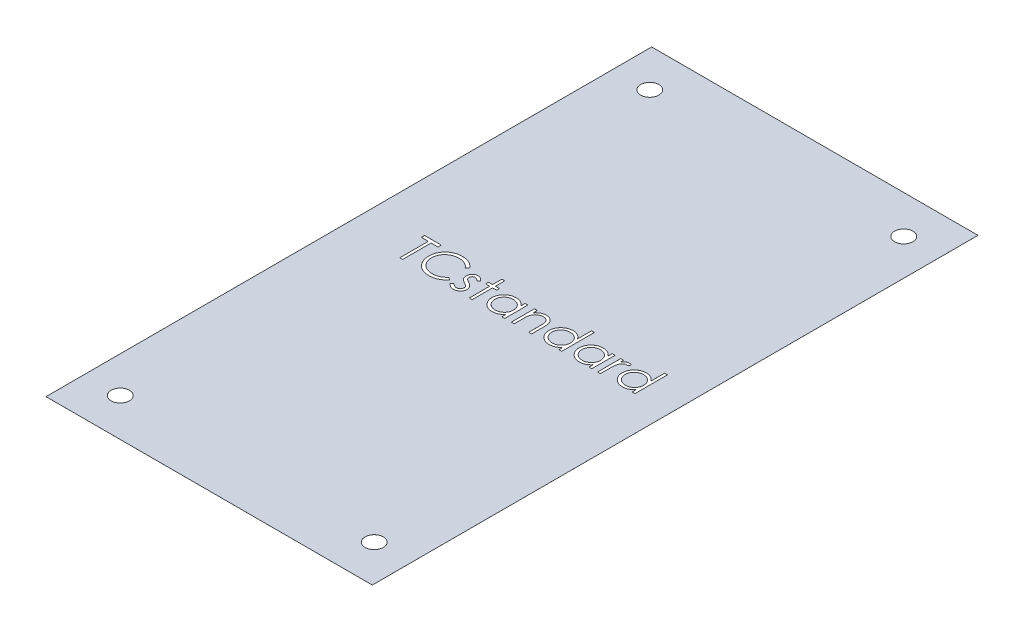
from build123d import *

# Parameters (mm, degrees)
SKETCH2_W           = 65.278
SKETCH2_H           = 121.158
BOSS_EXTRUDE1_DEPTH = 0.00254
SKETCH3_R           = 1.8288
CUT_EXTRUDE1_DEPTH  = 69.812205083
CUT_EXTRUDE2_DEPTH  = 2.54


with BuildPart() as part:
    # Sketch2 → Boss-Extrude1 (new body)
    with BuildSketch(Plane(origin=(0, 0, 0), x_dir=(1, 0, 0), z_dir=(0, 1, 0))):
        Rectangle(SKETCH2_W, SKETCH2_H)
    extrude(amount=BOSS_EXTRUDE1_DEPTH)

    # Sketch3 → Cut-Extrude1 (cut, through all)
    with BuildSketch(Plane(origin=(0, 0.00254, 0), x_dir=(1, 0, 0), z_dir=(0, 1, 0))):
        with Locations(Location((-25.4, 52.959, 0), (0, 0, 270))):
            Circle(SKETCH3_R)
        with Locations(Location((25.4, 52.959, 0), (0, 0, 270))):
            Circle(SKETCH3_R)
        with Locations(Location((25.4, -52.959, 0), (0, 0, 270))):
            Circle(SKETCH3_R)
        with Locations(Location((-25.4, -52.959, 0), (0, 0, 270))):
            Circle(SKETCH3_R)
    extrude(amount=-CUT_EXTRUDE1_DEPTH, mode=Mode.SUBTRACT)

    # Sketch5 → Cut-Extrude2 (cut)
    # profile 1 of 10: a face of its own
    with BuildSketch(Plane(origin=(0, 0.00254, 0), x_dir=(1, 0, 0), z_dir=(0, 1, 0))):
        Polygon((-22.692849894, 4.554319382), (-22.692849894, 5.205601433), (-19.355029382, 5.205601433), (-19.355029382, 4.554319382), (-20.739003741, 4.554319382), (-20.739003741, -1.144398567), (-21.308875535, -1.144398567), (-21.308875535, 4.554319382), align=None)
    # profile 2 of 10: a face of its own
    with BuildSketch(Plane(origin=(0, 0.00254, 0), x_dir=(1, 0, 0), z_dir=(0, 1, 0))):
        with BuildLine():
            Line((-12.516567843, 4.040417138), (-13.015205664, 3.658806561))
            add(Edge.make_bspline(
                [(-13.015205664, 3.658806561), (-13.050776347, 3.701199107), (-13.121438143, 3.785412654), (-13.235119839, 3.90366697), (-13.353595677, 4.014456802), (-13.476820368, 4.118309926), (-13.607011914, 4.21159463), (-13.741016506, 4.299172202), (-13.881075816, 4.377672241), (-14.074753963, 4.472855087), (-14.32811506, 4.572180254), (-14.647057125, 4.655461831), (-14.979998689, 4.708477392), (-15.207142906, 4.714219319), (-15.322677619, 4.717139895)],
                knots=[0, 0, 0, 0, 0.757959112, 1.505699292, 2.245454638, 2.979532153, 3.711538275, 4.438200793, 5.171680507, 5.909471876, 7.393775596, 8.890124382, 10.418191784, 12, 12, 12, 12], degree=3))
            add(Edge.make_bspline(
                [(-15.322677619, 4.717139895), (-15.386328748, 4.716406991), (-15.513040263, 4.714947986), (-15.701088208, 4.695700002), (-15.885624743, 4.668646807), (-16.066529832, 4.628505149), (-16.243573199, 4.577754826), (-16.417912272, 4.517111575), (-16.587022931, 4.44208208), (-16.753244592, 4.359154237), (-16.912501161, 4.265487301), (-17.063186747, 4.163318791), (-17.204751775, 4.053792002), (-17.337308228, 3.936496423), (-17.46099162, 3.811960295), (-17.574905741, 3.678856418), (-17.678656414, 3.537610332), (-17.77430016, 3.390084578), (-17.859957547, 3.236708871), (-17.931676043, 3.076915528), (-17.995185336, 2.913440941), (-18.045439676, 2.744438121), (-18.085217014, 2.571096246), (-18.112662917, 2.392950102), (-18.131692001, 2.210371855), (-18.13314375, 2.086620673), (-18.133875535, 2.024241257)],
                knots=[0, 0, 0, 0, 1.054917814, 2.100044995, 3.131103042, 4.146048494, 5.169673617, 6.183595914, 7.203665975, 8.234915748, 9.262203917, 10.264457458, 11.251630812, 12.227803204, 13.197192746, 14.159520551, 15.12972552, 16.100847026, 17.073214652, 18.039054194, 19.002613845, 19.979014051, 20.95965708, 21.949030935, 22.966165397, 24, 24, 24, 24], degree=3))
            add(Edge.make_bspline(
                [(-18.133875535, 2.024241257), (-18.131586235, 1.930385862), (-18.127091498, 1.746113244), (-18.08708952, 1.476200851), (-18.026301712, 1.217627628), (-17.935196308, 0.972009914), (-17.822857459, 0.736319036), (-17.680906635, 0.514542831), (-17.516502346, 0.303329921), (-17.327318757, 0.107672001), (-17.119753919, -0.071060043), (-16.897054137, -0.228450384), (-16.659774072, -0.359650242), (-16.410533614, -0.468826602), (-16.147414807, -0.552749523), (-15.870890809, -0.611830147), (-15.581563046, -0.650369531), (-15.38386142, -0.654059223), (-15.283244526, -0.655937028)],
                knots=[0, 0, 0, 0, 1.029171465, 2.020641659, 2.987623507, 3.938342917, 4.889210282, 5.84687017, 6.821220943, 7.821438502, 8.827599549, 9.822697543, 10.807740252, 11.797342354, 12.80366471, 13.83203677, 14.896651826, 16, 16, 16, 16], degree=3))
            add(Edge.make_bspline(
                [(-15.283244526, -0.655937028), (-15.17238679, -0.652873099), (-14.954192247, -0.646842554), (-14.634210256, -0.595753631), (-14.327893939, -0.512917123), (-14.035226817, -0.396988035), (-13.757033959, -0.24628387), (-13.492880018, -0.063589149), (-13.242542026, 0.152833969), (-13.092008414, 0.318084787), (-13.015205664, 0.402396305)],
                knots=[0, 0, 0, 0, 1.028121516, 2.023589091, 2.998037872, 3.967518031, 4.937445131, 5.927275754, 6.942489185, 8, 8, 8, 8], degree=3))
            Line((-13.015205664, 0.402396305), (-12.516567843, 0.024601834))
            add(Edge.make_bspline(
                [(-12.516567843, 0.024601834), (-12.556696414, -0.027175072), (-12.636761342, -0.130480875), (-12.766406601, -0.276116691), (-12.902981127, -0.413102584), (-13.047499343, -0.540334125), (-13.198298765, -0.660357227), (-13.358087103, -0.769761978), (-13.524763777, -0.87007544), (-13.697764045, -0.961927146), (-13.8769041, -1.043419865), (-14.061969289, -1.113185987), (-14.252161905, -1.173284001), (-14.447490641, -1.2227268), (-14.648360657, -1.261318624), (-14.854047089, -1.287117177), (-15.064993863, -1.304791793), (-15.207309012, -1.306402726), (-15.27942842, -1.30721908)],
                knots=[0, 0, 0, 0, 0.986787822, 1.968848986, 2.935600012, 3.899624008, 4.868462664, 5.837806735, 6.815139263, 7.798259679, 8.787526145, 9.778297419, 10.776456485, 11.791383307, 12.812564526, 13.85620153, 14.913611965, 16, 16, 16, 16], degree=3))
            add(Edge.make_bspline(
                [(-15.27942842, -1.30721908), (-15.347724787, -1.30674375), (-15.482772397, -1.305803845), (-15.682160132, -1.290578056), (-15.8762698, -1.269804962), (-16.064546621, -1.238526438), (-16.248018033, -1.201615993), (-16.425020808, -1.152138141), (-16.597296689, -1.096713225), (-16.764153536, -1.03157132), (-16.925733277, -0.958063389), (-17.081514763, -0.874984418), (-17.231426348, -0.783033035), (-17.376941897, -0.684236088), (-17.515911799, -0.575420126), (-17.649540338, -0.458096374), (-17.77857683, -0.332660269), (-17.858410273, -0.242209321), (-17.898549013, -0.196732301)],
                knots=[0, 0, 0, 0, 1.114604814, 2.203992996, 3.262667896, 4.300477797, 5.318619304, 6.316056647, 7.298880507, 8.271930387, 9.238335007, 10.195173496, 11.151986948, 12.108099108, 13.064862484, 14.031167946, 15.010108607, 16, 16, 16, 16], degree=3))
            add(Edge.make_bspline(
                [(-17.898549013, -0.196732301), (-17.962839395, -0.117736144), (-18.090643989, 0.039302459), (-18.254157729, 0.293821311), (-18.394125436, 0.55955649), (-18.507293178, 0.837904075), (-18.595762708, 1.128239478), (-18.657051448, 1.430709054), (-18.69687793, 1.74503032), (-18.701432311, 1.958819923), (-18.70374733, 2.067490456)],
                knots=[0, 0, 0, 0, 0.994628077, 1.977248131, 2.950237994, 3.925870899, 4.908910175, 5.911660606, 6.938484602, 8, 8, 8, 8], degree=3))
            add(Edge.make_bspline(
                [(-18.70374733, 2.067490456), (-18.700925765, 2.181709636), (-18.695374511, 2.406428742), (-18.648210711, 2.736218628), (-18.572339466, 3.052179023), (-18.46457654, 3.353720103), (-18.327951117, 3.642427897), (-18.15917426, 3.91609694), (-17.960206731, 4.176477419), (-17.732609001, 4.419618468), (-17.48302255, 4.641939865), (-17.21574413, 4.83753112), (-16.931296883, 5.000304328), (-16.632814495, 5.136368794), (-16.318061902, 5.24095232), (-15.987710646, 5.31416453), (-15.642381472, 5.359734156), (-15.406773929, 5.36549489), (-15.287060632, 5.368421946)],
                knots=[0, 0, 0, 0, 1.032925535, 2.032216505, 3.007276963, 3.968222605, 4.92396291, 5.891752235, 6.871517503, 7.883894988, 8.900124299, 9.891468569, 10.874487609, 11.85992873, 12.854644235, 13.869047385, 14.917252991, 16, 16, 16, 16], degree=3))
            add(Edge.make_bspline(
                [(-15.287060632, 5.368421946), (-15.21410009, 5.36754721), (-15.069682045, 5.365815757), (-14.85604509, 5.348931756), (-14.648051153, 5.320785642), (-14.445556943, 5.282475058), (-14.24757734, 5.234927489), (-14.055625474, 5.172987234), (-13.868574999, 5.102163813), (-13.687605609, 5.02059631), (-13.513585582, 4.929035222), (-13.346569118, 4.828495448), (-13.187882875, 4.719101629), (-13.03641025, 4.601784154), (-12.894685124, 4.474061054), (-12.758683584, 4.339445415), (-12.6330242, 4.194059763), (-12.555457689, 4.091725097), (-12.516567843, 4.040417138)],
                knots=[0, 0, 0, 0, 1.096760587, 2.17092713, 3.219439832, 4.250915756, 5.268269357, 6.278326846, 7.281116186, 8.274029601, 9.260640565, 10.235837813, 11.203064059, 12.156899882, 13.114053108, 14.069676657, 15.032185724, 16, 16, 16, 16], degree=3))
        make_face()
    # profile 3 of 10: a face of its own
    with BuildSketch(Plane(origin=(0, 0.00254, 0), x_dir=(1, 0, 0), z_dir=(0, 1, 0))):
        with BuildLine():
            Line((-9.17874733, 2.917210007), (-9.565446048, 2.519062972))
            add(Edge.make_bspline(
                [(-9.565446048, 2.519062972), (-9.598811676, 2.557731109), (-9.663136679, 2.632278724), (-9.765156651, 2.731950259), (-9.866799475, 2.815655849), (-9.966673751, 2.886326375), (-10.067290896, 2.939755541), (-10.167470162, 2.978753362), (-10.267315273, 3.002886638), (-10.334055652, 3.00599712), (-10.36682826, 3.00752451)],
                knots=[0, 0, 0, 0, 1.26578478, 2.440284043, 3.530471711, 4.527705817, 5.468200915, 6.346673037, 7.188140097, 8, 8, 8, 8], degree=3))
            add(Edge.make_bspline(
                [(-10.36682826, 3.00752451), (-10.406995439, 3.005574383), (-10.486038762, 3.00173681), (-10.599297032, 2.963431015), (-10.704436023, 2.904632304), (-10.795435115, 2.821232159), (-10.872519906, 2.7255027), (-10.928787585, 2.618466511), (-10.963197298, 2.503353631), (-10.967560169, 2.42347089), (-10.969772971, 2.382955199)],
                knots=[0, 0, 0, 0, 0.99966794, 1.967205029, 2.953328237, 3.988086729, 5.028030931, 6.008226631, 6.989793394, 8, 8, 8, 8], degree=3))
            add(Edge.make_bspline(
                [(-10.969772971, 2.382955199), (-10.967757641, 2.346284776), (-10.96373266, 2.273047304), (-10.932442256, 2.165010157), (-10.882610954, 2.059678102), (-10.836037887, 1.995156829), (-10.8120406, 1.961911529)],
                knots=[0, 0, 0, 0, 0.960159726, 1.917612774, 2.927026955, 4, 4, 4, 4], degree=3))
            add(Edge.make_bspline(
                [(-10.8120406, 1.961911529), (-10.797592547, 1.944159498), (-10.766841687, 1.906376536), (-10.709131952, 1.853936688), (-10.64377684, 1.795984318), (-10.565182096, 1.738041771), (-10.476733803, 1.677024212), (-10.376513958, 1.615334628), (-10.267703071, 1.5482706), (-10.189802529, 1.505735696), (-10.149310231, 1.483626273)],
                knots=[0, 0, 0, 0, 0.66740084, 1.420478572, 2.27185888, 3.217733974, 4.268547843, 5.408967954, 6.65319498, 8, 8, 8, 8], degree=3))
            add(Edge.make_bspline(
                [(-10.149310231, 1.483626273), (-10.099937027, 1.455967664), (-10.004564254, 1.402540338), (-9.869050233, 1.319609876), (-9.746065173, 1.237184291), (-9.634567034, 1.156145095), (-9.53670118, 1.074224892), (-9.449498349, 0.994563676), (-9.375133601, 0.914754502), (-9.33348862, 0.858995853), (-9.313583068, 0.832344222)],
                knots=[0, 0, 0, 0, 1.27191281, 2.456916733, 3.569705269, 4.599008579, 5.553216877, 6.436649441, 7.252746552, 8, 8, 8, 8], degree=3))
            add(Edge.make_bspline(
                [(-9.313583068, 0.832344222), (-9.280543968, 0.778521462), (-9.214790027, 0.671404181), (-9.145741458, 0.495022177), (-9.105717817, 0.307950265), (-9.100162074, 0.179984666), (-9.097337074, 0.114916337)],
                knots=[0, 0, 0, 0, 0.995354457, 1.980940102, 2.973342416, 4, 4, 4, 4], degree=3))
            add(Edge.make_bspline(
                [(-9.097337074, 0.114916337), (-9.098642514, 0.069070886), (-9.101215026, -0.021272584), (-9.119100376, -0.154322917), (-9.149861547, -0.281567043), (-9.191760215, -0.404385631), (-9.248337577, -0.520425422), (-9.314645724, -0.632614045), (-9.394247349, -0.738524662), (-9.485127416, -0.838018204), (-9.584632813, -0.92888806), (-9.690779664, -1.008760091), (-9.803698685, -1.075116388), (-9.922583025, -1.130026372), (-10.047702797, -1.173693068), (-10.179077565, -1.203923661), (-10.316289734, -1.222017099), (-10.4095981, -1.224528934), (-10.457142763, -1.225808823)],
                knots=[0, 0, 0, 0, 1.032770009, 2.035186124, 3.017557409, 3.978232242, 4.952395191, 5.920591857, 6.910227898, 7.931268572, 8.952309245, 9.941945286, 10.918353717, 11.897095711, 12.887975737, 13.898235213, 14.929059601, 16, 16, 16, 16], degree=3))
            add(Edge.make_bspline(
                [(-10.457142763, -1.225808823), (-10.521308924, -1.224007781), (-10.648749663, -1.220430723), (-10.837235296, -1.18685544), (-11.021422959, -1.134612368), (-11.19991881, -1.062556316), (-11.368731045, -0.971568594), (-11.523182866, -0.862598252), (-11.663810805, -0.739244971), (-11.743853959, -0.644697261), (-11.783875535, -0.597423407)],
                knots=[0, 0, 0, 0, 1.013940152, 2.01379169, 3.017749504, 4.037548394, 5.051665909, 6.043208538, 7.021604269, 8, 8, 8, 8], degree=3))
            Line((-11.783875535, -0.597423407), (-11.406081064, -0.16747549))
            add(Edge.make_bspline(
                [(-11.406081064, -0.16747549), (-11.370208258, -0.206219134), (-11.300663399, -0.281329547), (-11.189445477, -0.38134085), (-11.07627142, -0.465163157), (-10.962271346, -0.535273352), (-10.845757747, -0.589294441), (-10.727383561, -0.627246747), (-10.607389563, -0.651638353), (-10.526795116, -0.654501808), (-10.486399574, -0.655937028)],
                knots=[0, 0, 0, 0, 1.179806542, 2.287233372, 3.337373186, 4.324005949, 5.273901747, 6.200048787, 7.097828587, 8, 8, 8, 8], degree=3))
            add(Edge.make_bspline(
                [(-10.486399574, -0.655937028), (-10.431394194, -0.65344996), (-10.323922909, -0.648590647), (-10.169992089, -0.604472494), (-10.027863439, -0.535293867), (-9.904449655, -0.437168772), (-9.799398591, -0.322949376), (-9.723328903, -0.194290902), (-9.675656413, -0.05496926), (-9.67005753, 0.041609347), (-9.667208869, 0.090747667)],
                knots=[0, 0, 0, 0, 1.072336372, 2.095165389, 3.102688358, 4.141489647, 5.156069229, 6.117746104, 7.042326257, 8, 8, 8, 8], degree=3))
            add(Edge.make_bspline(
                [(-9.667208869, 0.090747667), (-9.669179717, 0.13122369), (-9.673070893, 0.211138178), (-9.703629401, 0.326799511), (-9.751912719, 0.436508063), (-9.799455438, 0.500714994), (-9.823669205, 0.533415936)],
                knots=[0, 0, 0, 0, 1.013901739, 2.00181326, 2.98231254, 4, 4, 4, 4], degree=3))
            add(Edge.make_bspline(
                [(-9.823669205, 0.533415936), (-9.838224121, 0.549808665), (-9.869929984, 0.585517948), (-9.92808735, 0.637089162), (-9.997723014, 0.692675428), (-10.079620167, 0.751334168), (-10.173943905, 0.812291638), (-10.281076525, 0.875228034), (-10.399550385, 0.943132622), (-10.483317101, 0.988162568), (-10.527104702, 1.011701193)],
                knots=[0, 0, 0, 0, 0.615000592, 1.339693406, 2.178160186, 3.116406724, 4.166410947, 5.330106347, 6.604359322, 8, 8, 8, 8], degree=3))
            add(Edge.make_bspline(
                [(-10.527104702, 1.011701193), (-10.574360749, 1.038079332), (-10.666005305, 1.089234961), (-10.795812533, 1.168911278), (-10.912919876, 1.249950477), (-11.020145204, 1.327806628), (-11.114780171, 1.406584626), (-11.196451963, 1.486371925), (-11.268376083, 1.563950757), (-11.308194959, 1.618918709), (-11.327214878, 1.64517475)],
                knots=[0, 0, 0, 0, 1.262093308, 2.447601706, 3.550203992, 4.582594899, 5.537233252, 6.418365656, 7.244515135, 8, 8, 8, 8], degree=3))
            add(Edge.make_bspline(
                [(-11.327214878, 1.64517475), (-11.360108966, 1.698053223), (-11.425908637, 1.803828648), (-11.489799056, 1.980377656), (-11.533715708, 2.16624226), (-11.537638902, 2.29448841), (-11.539644766, 2.360058565)],
                knots=[0, 0, 0, 0, 0.985009483, 1.970363186, 2.962279964, 4, 4, 4, 4], degree=3))
            add(Edge.make_bspline(
                [(-11.539644766, 2.360058565), (-11.538675583, 2.402921787), (-11.536778755, 2.486811185), (-11.521640261, 2.610071616), (-11.494078157, 2.727180409), (-11.459507083, 2.839896289), (-11.411459346, 2.946035803), (-11.354044633, 3.047014357), (-11.286576019, 3.14269238), (-11.208846048, 3.231598063), (-11.123381135, 3.312350697), (-11.031043481, 3.382742494), (-10.933909787, 3.44280688), (-10.831568797, 3.493180815), (-10.723037368, 3.531283323), (-10.609074124, 3.55751315), (-10.489909743, 3.575030447), (-10.408446272, 3.576596328), (-10.36682826, 3.577396305)],
                knots=[0, 0, 0, 0, 1.087655834, 2.128696564, 3.144119009, 4.137814668, 5.115653402, 6.093965665, 7.082169637, 8.081268856, 9.086088321, 10.061021666, 11.022561449, 11.980240094, 12.950172527, 13.934149372, 14.944599409, 16, 16, 16, 16], degree=3))
            add(Edge.make_bspline(
                [(-10.36682826, 3.577396305), (-10.317494088, 3.575392715), (-10.217900285, 3.571347951), (-10.068485464, 3.53922477), (-9.919290686, 3.486368995), (-9.769932608, 3.413368972), (-9.621505369, 3.318904782), (-9.472703357, 3.204733054), (-9.321740217, 3.071604914), (-9.22747662, 2.969824891), (-9.17874733, 2.917210007)],
                knots=[0, 0, 0, 0, 0.845714091, 1.707292901, 2.609013841, 3.555613372, 4.552488639, 5.621697636, 6.770543573, 8, 8, 8, 8], degree=3))
        make_face()
    # profile 4 of 10: a face of its own
    with BuildSketch(Plane(origin=(0, 0.00254, 0), x_dir=(1, 0, 0), z_dir=(0, 1, 0))):
        Polygon((-7.387721689, 5.368421946), (-6.817849894, 5.368421946), (-6.817849894, 3.495986049), (-6.00374733, 3.495986049), (-6.00374733, 2.926114254), (-6.817849894, 2.926114254), (-6.817849894, -1.144398567), (-7.387721689, -1.144398567), (-7.387721689, 2.926114254), (-8.201824253, 2.926114254), (-8.201824253, 3.495986049), (-7.387721689, 3.495986049), align=None)
    # profile 5 of 10: a face of its own
    with BuildSketch(Plane(origin=(0, 0.00254, 0), x_dir=(1, 0, 0), z_dir=(0, 1, 0))):
        with BuildLine():
            Line((-0.305029382, 3.495986049), (-0.305029382, -1.144398567))
            Line((-0.305029382, -1.144398567), (-0.874901177, -1.144398567))
            Line((-0.874901177, -1.144398567), (-0.874901177, -0.34174432))
            add(Edge.make_bspline(
                [(-0.874901177, -0.34174432), (-0.939160982, -0.414387583), (-1.064564802, -0.556151825), (-1.274007973, -0.741358052), (-1.49601881, -0.894444436), (-1.729519778, -1.018087854), (-1.97430002, -1.110964871), (-2.229816921, -1.176979759), (-2.496174712, -1.21942286), (-2.678061127, -1.223661072), (-2.770233709, -1.225808823)],
                knots=[0, 0, 0, 0, 1.074387032, 2.096679803, 3.090159297, 4.057316773, 5.018401886, 5.985159533, 6.978961417, 8, 8, 8, 8], degree=3))
            add(Edge.make_bspline(
                [(-2.770233709, -1.225808823), (-2.852181282, -1.223583834), (-3.013785525, -1.219196055), (-3.251509708, -1.185155876), (-3.480277075, -1.13049032), (-3.700303799, -1.054470134), (-3.91016612, -0.953630644), (-4.111660867, -0.832905808), (-4.30374418, -0.689140302), (-4.483488258, -0.524787736), (-4.649009173, -0.346271117), (-4.794263196, -0.15586991), (-4.915372355, 0.045592556), (-5.01664593, 0.255565563), (-5.094653584, 0.475665489), (-5.14903432, 0.705131208), (-5.183034845, 0.943691407), (-5.187420809, 1.106141684), (-5.189644766, 1.188514093)],
                knots=[0, 0, 0, 0, 1.033919861, 2.038935746, 3.024066025, 3.998881131, 4.97069526, 5.957263378, 6.95902576, 7.993208707, 9.027059324, 10.027763471, 11.009749337, 11.988697705, 12.965288445, 13.950418724, 14.960734635, 16, 16, 16, 16], degree=3))
            add(Edge.make_bspline(
                [(-5.189644766, 1.188514093), (-5.187371518, 1.269183956), (-5.182877429, 1.428663921), (-5.149398016, 1.663212416), (-5.093098901, 1.889124118), (-5.014090663, 2.105671715), (-4.912777401, 2.313117234), (-4.789536444, 2.511607394), (-4.644358889, 2.701689015), (-4.476986665, 2.878892527), (-4.295676439, 3.042578498), (-4.101713456, 3.184834909), (-3.899922645, 3.307692621), (-3.68717404, 3.405035356), (-3.466616579, 3.483791875), (-3.236286756, 3.53828026), (-2.997142892, 3.570388257), (-2.83478157, 3.575037843), (-2.752425215, 3.577396305)],
                knots=[0, 0, 0, 0, 1.020392517, 2.01726096, 2.990465484, 3.961182959, 4.928053699, 5.906110375, 6.912531644, 7.948652711, 8.985773172, 9.998621852, 10.987621588, 11.969261332, 12.953316658, 13.946091881, 14.958173133, 16, 16, 16, 16], degree=3))
            add(Edge.make_bspline(
                [(-2.752425215, 3.577396305), (-2.657719756, 3.574787813), (-2.472006822, 3.569672683), (-2.200357434, 3.527104592), (-1.943373881, 3.455189087), (-1.699072414, 3.357367341), (-1.468330312, 3.227376075), (-1.25333204, 3.063401003), (-1.05182752, 2.866476278), (-0.935023277, 2.715218472), (-0.874901177, 2.63736225)],
                knots=[0, 0, 0, 0, 1.038897134, 2.037228247, 3.008116434, 3.962042015, 4.918381754, 5.904844433, 6.921570401, 8, 8, 8, 8], degree=3))
            Line((-0.874901177, 2.63736225), (-0.874901177, 3.495986049))
            Line((-0.874901177, 3.495986049), (-0.305029382, 3.495986049))
        make_face()
        with BuildLine():
            add(Edge.make_bspline(
                [(-2.744793003, 3.00752451), (-2.828094731, 3.004560624), (-2.992519091, 2.998710386), (-3.233898923, 2.953038473), (-3.464881831, 2.877047852), (-3.684312566, 2.773122117), (-3.888724902, 2.642441409), (-4.071411991, 2.484378328), (-4.233868034, 2.303245459), (-4.370498742, 2.099860202), (-4.481878644, 1.881822808), (-4.560195973, 1.653904185), (-4.611847322, 1.420215154), (-4.617124209, 1.261714281), (-4.619772971, 1.182153917)],
                knots=[0, 0, 0, 0, 1.031046209, 2.035121221, 3.029706178, 4.034933723, 5.034054252, 6.02443088, 7.017295772, 8.038157696, 9.050218397, 10.03989886, 11.016116709, 12, 12, 12, 12], degree=3))
            add(Edge.make_bspline(
                [(-4.619772971, 1.182153917), (-4.616389522, 1.103069008), (-4.609635886, 0.945209177), (-4.561102483, 0.711201559), (-4.47967757, 0.483229226), (-4.36856697, 0.263227137), (-4.229435522, 0.058967413), (-4.06816611, -0.125618238), (-3.883199171, -0.284349349), (-3.678316408, -0.417223232), (-3.45949909, -0.524560949), (-3.2293861, -0.59924718), (-2.992303157, -0.647466868), (-2.831099637, -0.653099276), (-2.749881144, -0.655937028)],
                knots=[0, 0, 0, 0, 0.979072187, 1.954306742, 2.945804271, 3.96968567, 4.997920485, 5.998718438, 6.996577872, 8.005894225, 9.015743152, 10.005417472, 10.995077863, 12, 12, 12, 12], degree=3))
            add(Edge.make_bspline(
                [(-2.749881144, -0.655937028), (-2.667428204, -0.65292538), (-2.503437482, -0.646935509), (-2.261341541, -0.60106807), (-2.02640068, -0.525287536), (-1.80181528, -0.420241978), (-1.592598871, -0.290053632), (-1.40482415, -0.137640767), (-1.246045179, 0.039620724), (-1.111438587, 0.234432289), (-1.005891759, 0.447995483), (-0.929009481, 0.675387515), (-0.883554537, 0.916616301), (-0.877825513, 1.081469425), (-0.874901177, 1.165617459)],
                knots=[0, 0, 0, 0, 1.01762866, 2.023962475, 3.030623092, 4.058876274, 5.077231937, 6.066672613, 7.034107872, 8.005628644, 8.981990164, 9.965428785, 10.961468474, 12, 12, 12, 12], degree=3))
            add(Edge.make_bspline(
                [(-0.874901177, 1.165617459), (-0.876642267, 1.22973038), (-0.880069285, 1.355924898), (-0.906250461, 1.541213394), (-0.947897256, 1.718530297), (-1.006582451, 1.888062032), (-1.083673781, 2.048871275), (-1.17665187, 2.202112668), (-1.287151758, 2.346989209), (-1.413394649, 2.481505923), (-1.551580088, 2.604199648), (-1.697801612, 2.713717627), (-1.853791624, 2.803685829), (-2.01692682, 2.878146422), (-2.187490241, 2.937399451), (-2.366869794, 2.976928553), (-2.553158813, 3.004070849), (-2.680242371, 3.006361169), (-2.744793003, 3.00752451)],
                knots=[0, 0, 0, 0, 1.050140795, 2.067009409, 3.05949893, 4.030605086, 5.00011959, 5.97591094, 6.962425594, 7.979863591, 8.993523472, 9.986985069, 10.967611495, 11.937549037, 12.921786183, 13.919465291, 14.943216303, 16, 16, 16, 16], degree=3))
        make_face(mode=Mode.SUBTRACT)
    # profile 6 of 10: a face of its own
    with BuildSketch(Plane(origin=(0, 0.00254, 0), x_dir=(1, 0, 0), z_dir=(0, 1, 0))):
        with BuildLine():
            Line((0.997534721, 3.495986049), (1.567406516, 3.495986049))
            Line((1.567406516, 3.495986049), (1.567406516, 2.65898685))
            add(Edge.make_bspline(
                [(1.567406516, 2.65898685), (1.628253368, 2.734901504), (1.746328808, 2.882216539), (1.942968955, 3.075838153), (2.150784317, 3.235395919), (2.368502238, 3.36258423), (2.596418271, 3.458463109), (2.833143132, 3.527707013), (3.080094099, 3.56922663), (3.248032434, 3.574651762), (3.332991452, 3.577396305)],
                knots=[0, 0, 0, 0, 1.12780773, 2.188550248, 3.19190651, 4.159438251, 5.104880172, 6.052711206, 7.014878035, 8, 8, 8, 8], degree=3))
            add(Edge.make_bspline(
                [(3.332991452, 3.577396305), (3.418862745, 3.574230022), (3.586933579, 3.568032842), (3.831640919, 3.519016845), (4.060192648, 3.435296168), (4.271773842, 3.320611412), (4.462504643, 3.17799681), (4.630008302, 3.011848549), (4.768553051, 2.820738798), (4.861439696, 2.643441071), (4.922627656, 2.48616283), (4.961149183, 2.351458012), (4.993862535, 2.201383652), (5.022222992, 2.036393255), (5.041412895, 1.855330824), (5.056548195, 1.658938583), (5.067395255, 1.447280146), (5.067825616, 1.300891551), (5.068047541, 1.225403116)],
                knots=[0, 0, 0, 0, 1.235846778, 2.418850247, 3.575807741, 4.728682307, 5.871620074, 6.994088408, 8.11269785, 9.256955736, 9.865816715, 10.540099792, 11.271859618, 12.076849838, 12.949306005, 13.892391288, 14.913166135, 16, 16, 16, 16], degree=3))
            Line((5.068047541, 1.225403116), (5.068047541, -1.144398567))
            Line((5.068047541, -1.144398567), (4.498175747, -1.144398567))
            Line((4.498175747, -1.144398567), (4.498175747, 1.038413933))
            add(Edge.make_bspline(
                [(4.498175747, 1.038413933), (4.497825212, 1.101591798), (4.497154699, 1.2224403), (4.495039883, 1.395466956), (4.489942091, 1.55237832), (4.482778723, 1.692799258), (4.472293911, 1.816594933), (4.461367137, 1.924017478), (4.448004965, 2.014930505), (4.436097965, 2.069658583), (4.430757878, 2.094203196)],
                knots=[0, 0, 0, 0, 1.430800155, 2.736877192, 3.918605307, 4.986035426, 5.920637409, 6.731861385, 7.431261377, 8, 8, 8, 8], degree=3))
            add(Edge.make_bspline(
                [(4.430757878, 2.094203196), (4.411480128, 2.166250632), (4.374376424, 2.304919654), (4.28269334, 2.493014551), (4.166916183, 2.653031263), (4.025587228, 2.783980458), (3.860071619, 2.885890405), (3.67082866, 2.956600294), (3.459684555, 3.000825811), (3.311177318, 3.005229322), (3.233772702, 3.00752451)],
                knots=[0, 0, 0, 0, 1.084156227, 2.086665306, 3.027808233, 3.945421172, 4.874247719, 5.839848303, 6.874090471, 8, 8, 8, 8], degree=3))
            add(Edge.make_bspline(
                [(3.233772702, 3.00752451), (3.187929904, 3.006660902), (3.097208193, 3.004951843), (2.962678958, 2.987804488), (2.832187958, 2.959758433), (2.704425579, 2.921896762), (2.581947153, 2.869895216), (2.460817653, 2.810877644), (2.345598238, 2.737311603), (2.233832075, 2.655322904), (2.129850267, 2.564464914), (2.033097424, 2.468589874), (1.946849873, 2.36648985), (1.868710991, 2.259809945), (1.801258999, 2.147085039), (1.742379825, 2.029402654), (1.692422207, 1.906607899), (1.667597894, 1.821381716), (1.655176948, 1.778738452)],
                knots=[0, 0, 0, 0, 1.023777757, 2.026029729, 3.023749952, 4.003683103, 4.997618607, 5.993177895, 7.010360494, 8.046726602, 9.087585522, 10.09234134, 11.086953743, 12.070360549, 13.043493632, 14.017870808, 15.008233677, 16, 16, 16, 16], degree=3))
            add(Edge.make_bspline(
                [(1.655176948, 1.778738452), (1.6480293, 1.747432584), (1.632469244, 1.679281346), (1.615663189, 1.567440757), (1.600409445, 1.438064088), (1.587642392, 1.291302313), (1.579831136, 1.126641596), (1.571314159, 0.944785148), (1.568213434, 0.745007819), (1.567683021, 0.605921605), (1.567406516, 0.533415936)],
                knots=[0, 0, 0, 0, 0.615963638, 1.340920617, 2.168419149, 3.115676021, 4.16674242, 5.331190069, 6.6087489, 8, 8, 8, 8], degree=3))
            Line((1.567406516, 0.533415936), (1.567406516, -1.144398567))
            Line((1.567406516, -1.144398567), (0.997534721, -1.144398567))
            Line((0.997534721, -1.144398567), (0.997534721, 3.495986049))
        make_face()
    # profile 7 of 10: a face of its own
    with BuildSketch(Plane(origin=(0, 0.00254, 0), x_dir=(1, 0, 0), z_dir=(0, 1, 0))):
        with BuildLine():
            Line((11.092406516, 5.368421946), (11.092406516, -1.144398567))
            Line((11.092406516, -1.144398567), (10.522534721, -1.144398567))
            Line((10.522534721, -1.144398567), (10.522534721, -0.34174432))
            add(Edge.make_bspline(
                [(10.522534721, -0.34174432), (10.458274915, -0.414387583), (10.332871096, -0.556151825), (10.123427925, -0.741358052), (9.901417088, -0.894444436), (9.667916119, -1.018087854), (9.423135878, -1.110964871), (9.167618977, -1.176979759), (8.901261186, -1.21942286), (8.719374771, -1.223661072), (8.627202189, -1.225808823)],
                knots=[0, 0, 0, 0, 1.074387032, 2.096679803, 3.090159297, 4.057316773, 5.018401886, 5.985159533, 6.978961417, 8, 8, 8, 8], degree=3))
            add(Edge.make_bspline(
                [(8.627202189, -1.225808823), (8.545254615, -1.223583834), (8.383650372, -1.219196055), (8.14592619, -1.185155876), (7.917158823, -1.13049032), (7.697132098, -1.054470134), (7.487269777, -0.953630644), (7.28577503, -0.832905808), (7.093691717, -0.689140302), (6.91394764, -0.524787736), (6.748426725, -0.346271117), (6.603172701, -0.15586991), (6.482063542, 0.045592556), (6.380789967, 0.255565563), (6.302782314, 0.475665489), (6.248401577, 0.705131208), (6.214401053, 0.943691407), (6.210015088, 1.106141684), (6.207791131, 1.188514093)],
                knots=[0, 0, 0, 0, 1.033919861, 2.038935746, 3.024066025, 3.998881131, 4.97069526, 5.957263378, 6.95902576, 7.993208707, 9.027059324, 10.027763471, 11.009749337, 11.988697705, 12.965288445, 13.950418724, 14.960734635, 16, 16, 16, 16], degree=3))
            add(Edge.make_bspline(
                [(6.207791131, 1.188514093), (6.210064379, 1.269183956), (6.214558468, 1.428663921), (6.248037881, 1.663212416), (6.304336997, 1.889124118), (6.383345235, 2.105671715), (6.484658496, 2.313117234), (6.607899454, 2.511607394), (6.753077009, 2.701689015), (6.920449233, 2.878892527), (7.101759459, 3.042578498), (7.295722442, 3.184834909), (7.497513252, 3.307692621), (7.710261857, 3.405035356), (7.930819319, 3.483791875), (8.161149142, 3.53828026), (8.400293006, 3.570388257), (8.562654327, 3.575037843), (8.645010682, 3.577396305)],
                knots=[0, 0, 0, 0, 1.020392517, 2.01726096, 2.990465484, 3.961182959, 4.928053699, 5.906110375, 6.912531644, 7.948652711, 8.985773172, 9.998621852, 10.987621588, 11.969261332, 12.953316658, 13.946091881, 14.958173133, 16, 16, 16, 16], degree=3))
            add(Edge.make_bspline(
                [(8.645010682, 3.577396305), (8.739746891, 3.574553145), (8.92570354, 3.568972338), (9.197662286, 3.522333644), (9.454905522, 3.444023851), (9.698914228, 3.336815383), (9.928233701, 3.197476878), (10.144544892, 3.029199251), (10.344086064, 2.82722), (10.462144942, 2.675524717), (10.522534721, 2.597929158)],
                knots=[0, 0, 0, 0, 1.031072012, 2.023879775, 2.993683497, 3.952812103, 4.918022106, 5.908088563, 6.929940113, 8, 8, 8, 8], degree=3))
            Line((10.522534721, 2.597929158), (10.522534721, 5.368421946))
            Line((10.522534721, 5.368421946), (11.092406516, 5.368421946))
        make_face()
        with BuildLine():
            add(Edge.make_bspline(
                [(8.652642894, 3.00752451), (8.569341167, 3.004560624), (8.404916807, 2.998710386), (8.163536974, 2.953038473), (7.932554066, 2.877047852), (7.713123331, 2.773122117), (7.508710995, 2.642441409), (7.326023907, 2.484378328), (7.163567863, 2.303245459), (7.026937155, 2.099860202), (6.915557254, 1.881822808), (6.837239924, 1.653904185), (6.785588575, 1.420215154), (6.780311688, 1.261714281), (6.777662926, 1.182153917)],
                knots=[0, 0, 0, 0, 1.031046209, 2.035121221, 3.029706178, 4.034933723, 5.034054252, 6.02443088, 7.017295772, 8.038157696, 9.050218397, 10.03989886, 11.016116709, 12, 12, 12, 12], degree=3))
            add(Edge.make_bspline(
                [(6.777662926, 1.182153917), (6.781046375, 1.103069008), (6.787800012, 0.945209177), (6.836333415, 0.711201559), (6.917758328, 0.483229226), (7.028868927, 0.263227137), (7.168000375, 0.058967413), (7.329269788, -0.125618238), (7.514236727, -0.284349349), (7.719119489, -0.417223232), (7.937936807, -0.524560949), (8.168049797, -0.59924718), (8.405132741, -0.647466868), (8.566336261, -0.653099276), (8.647554753, -0.655937028)],
                knots=[0, 0, 0, 0, 0.979072187, 1.954306742, 2.945804271, 3.96968567, 4.997920485, 5.998718438, 6.996577872, 8.005894225, 9.015743152, 10.005417472, 10.995077863, 12, 12, 12, 12], degree=3))
            add(Edge.make_bspline(
                [(8.647554753, -0.655937028), (8.730007694, -0.65292538), (8.893998415, -0.646935509), (9.136094356, -0.60106807), (9.371035217, -0.525287536), (9.595620618, -0.420241978), (9.804837027, -0.290053632), (9.992611748, -0.137640767), (10.151390719, 0.039620724), (10.285997311, 0.234432289), (10.391544138, 0.447995483), (10.468426417, 0.675387515), (10.51388136, 0.916616301), (10.519610384, 1.081469425), (10.522534721, 1.165617459)],
                knots=[0, 0, 0, 0, 1.01762866, 2.023962475, 3.030623092, 4.058876274, 5.077231937, 6.066672613, 7.034107872, 8.005628644, 8.981990164, 9.965428785, 10.961468474, 12, 12, 12, 12], degree=3))
            add(Edge.make_bspline(
                [(10.522534721, 1.165617459), (10.52079363, 1.22973038), (10.517366612, 1.355924898), (10.491185436, 1.541213394), (10.449538641, 1.718530297), (10.390853447, 1.888062032), (10.313762117, 2.048871275), (10.220784027, 2.202112668), (10.11028414, 2.346989209), (9.984041248, 2.481505923), (9.845855809, 2.604199648), (9.699634286, 2.713717627), (9.543644273, 2.803685829), (9.380509078, 2.878146422), (9.209945657, 2.937399451), (9.030566104, 2.976928553), (8.844277084, 3.004070849), (8.717193527, 3.006361169), (8.652642894, 3.00752451)],
                knots=[0, 0, 0, 0, 1.050140795, 2.067009409, 3.05949893, 4.030605086, 5.00011959, 5.97591094, 6.962425594, 7.979863591, 8.993523472, 9.986985069, 10.967611495, 11.937549037, 12.921786183, 13.919465291, 14.943216303, 16, 16, 16, 16], degree=3))
        make_face(mode=Mode.SUBTRACT)
    # profile 8 of 10: a face of its own
    with BuildSketch(Plane(origin=(0, 0.00254, 0), x_dir=(1, 0, 0), z_dir=(0, 1, 0))):
        with BuildLine():
            Line((17.11676549, 3.495986049), (17.11676549, -1.144398567))
            Line((17.11676549, -1.144398567), (16.546893695, -1.144398567))
            Line((16.546893695, -1.144398567), (16.546893695, -0.34174432))
            add(Edge.make_bspline(
                [(16.546893695, -0.34174432), (16.482633889, -0.414387583), (16.35723007, -0.556151825), (16.147786899, -0.741358052), (15.925776062, -0.894444436), (15.692275094, -1.018087854), (15.447494852, -1.110964871), (15.191977951, -1.176979759), (14.92562016, -1.21942286), (14.743733745, -1.223661072), (14.651561163, -1.225808823)],
                knots=[0, 0, 0, 0, 1.074387032, 2.096679803, 3.090159297, 4.057316773, 5.018401886, 5.985159533, 6.978961417, 8, 8, 8, 8], degree=3))
            add(Edge.make_bspline(
                [(14.651561163, -1.225808823), (14.56961359, -1.223583834), (14.408009347, -1.219196055), (14.170285164, -1.185155876), (13.941517797, -1.13049032), (13.721491072, -1.054470134), (13.511628751, -0.953630644), (13.310134005, -0.832905808), (13.118050692, -0.689140302), (12.938306614, -0.524787736), (12.772785699, -0.346271117), (12.627531676, -0.15586991), (12.506422517, 0.045592556), (12.405148942, 0.255565563), (12.327141288, 0.475665489), (12.272760552, 0.705131208), (12.238760027, 0.943691407), (12.234374063, 1.106141684), (12.232150106, 1.188514093)],
                knots=[0, 0, 0, 0, 1.033919861, 2.038935746, 3.024066025, 3.998881131, 4.97069526, 5.957263378, 6.95902576, 7.993208707, 9.027059324, 10.027763471, 11.009749337, 11.988697705, 12.965288445, 13.950418724, 14.960734635, 16, 16, 16, 16], degree=3))
            add(Edge.make_bspline(
                [(12.232150106, 1.188514093), (12.234423354, 1.269183956), (12.238917442, 1.428663921), (12.272396856, 1.663212416), (12.328695971, 1.889124118), (12.407704209, 2.105671715), (12.50901747, 2.313117234), (12.632258428, 2.511607394), (12.777435983, 2.701689015), (12.944808207, 2.878892527), (13.126118433, 3.042578498), (13.320081416, 3.184834909), (13.521872227, 3.307692621), (13.734620831, 3.405035356), (13.955178293, 3.483791875), (14.185508116, 3.53828026), (14.42465198, 3.570388257), (14.587013302, 3.575037843), (14.669369657, 3.577396305)],
                knots=[0, 0, 0, 0, 1.020392517, 2.01726096, 2.990465484, 3.961182959, 4.928053699, 5.906110375, 6.912531644, 7.948652711, 8.985773172, 9.998621852, 10.987621588, 11.969261332, 12.953316658, 13.946091881, 14.958173133, 16, 16, 16, 16], degree=3))
            add(Edge.make_bspline(
                [(14.669369657, 3.577396305), (14.764075115, 3.574787813), (14.94978805, 3.569672683), (15.221437438, 3.527104592), (15.478420991, 3.455189087), (15.722722458, 3.357367341), (15.95346456, 3.227376075), (16.168462832, 3.063401003), (16.369967351, 2.866476278), (16.486771595, 2.715218472), (16.546893695, 2.63736225)],
                knots=[0, 0, 0, 0, 1.038897134, 2.037228247, 3.008116434, 3.962042015, 4.918381754, 5.904844433, 6.921570401, 8, 8, 8, 8], degree=3))
            Line((16.546893695, 2.63736225), (16.546893695, 3.495986049))
            Line((16.546893695, 3.495986049), (17.11676549, 3.495986049))
        make_face()
        with BuildLine():
            add(Edge.make_bspline(
                [(14.677001868, 3.00752451), (14.593700141, 3.004560624), (14.429275781, 2.998710386), (14.187895949, 2.953038473), (13.95691304, 2.877047852), (13.737482306, 2.773122117), (13.53306997, 2.642441409), (13.350382881, 2.484378328), (13.187926837, 2.303245459), (13.051296129, 2.099860202), (12.939916228, 1.881822808), (12.861598898, 1.653904185), (12.80994755, 1.420215154), (12.804670662, 1.261714281), (12.8020219, 1.182153917)],
                knots=[0, 0, 0, 0, 1.031046209, 2.035121221, 3.029706178, 4.034933723, 5.034054252, 6.02443088, 7.017295772, 8.038157696, 9.050218397, 10.03989886, 11.016116709, 12, 12, 12, 12], degree=3))
            add(Edge.make_bspline(
                [(12.8020219, 1.182153917), (12.80540535, 1.103069008), (12.812158986, 0.945209177), (12.860692389, 0.711201559), (12.942117302, 0.483229226), (13.053227902, 0.263227137), (13.192359349, 0.058967413), (13.353628762, -0.125618238), (13.538595701, -0.284349349), (13.743478464, -0.417223232), (13.962295781, -0.524560949), (14.192408771, -0.59924718), (14.429491715, -0.647466868), (14.590695235, -0.653099276), (14.671913727, -0.655937028)],
                knots=[0, 0, 0, 0, 0.979072187, 1.954306742, 2.945804271, 3.96968567, 4.997920485, 5.998718438, 6.996577872, 8.005894225, 9.015743152, 10.005417472, 10.995077863, 12, 12, 12, 12], degree=3))
            add(Edge.make_bspline(
                [(14.671913727, -0.655937028), (14.754366668, -0.65292538), (14.918357389, -0.646935509), (15.160453331, -0.60106807), (15.395394192, -0.525287536), (15.619979592, -0.420241978), (15.829196001, -0.290053632), (16.016970722, -0.137640767), (16.175749693, 0.039620724), (16.310356285, 0.234432289), (16.415903112, 0.447995483), (16.492785391, 0.675387515), (16.538240335, 0.916616301), (16.543969358, 1.081469425), (16.546893695, 1.165617459)],
                knots=[0, 0, 0, 0, 1.01762866, 2.023962475, 3.030623092, 4.058876274, 5.077231937, 6.066672613, 7.034107872, 8.005628644, 8.981990164, 9.965428785, 10.961468474, 12, 12, 12, 12], degree=3))
            add(Edge.make_bspline(
                [(16.546893695, 1.165617459), (16.545152604, 1.22973038), (16.541725587, 1.355924898), (16.515544411, 1.541213394), (16.473897615, 1.718530297), (16.415212421, 1.888062032), (16.338121091, 2.048871275), (16.245143001, 2.202112668), (16.134643114, 2.346989209), (16.008400223, 2.481505923), (15.870214784, 2.604199648), (15.72399326, 2.713717627), (15.568003248, 2.803685829), (15.404868052, 2.878146422), (15.234304631, 2.937399451), (15.054925078, 2.976928553), (14.868636059, 3.004070849), (14.741552501, 3.006361169), (14.677001868, 3.00752451)],
                knots=[0, 0, 0, 0, 1.050140795, 2.067009409, 3.05949893, 4.030605086, 5.00011959, 5.97591094, 6.962425594, 7.979863591, 8.993523472, 9.986985069, 10.967611495, 11.937549037, 12.921786183, 13.919465291, 14.943216303, 16, 16, 16, 16], degree=3))
        make_face(mode=Mode.SUBTRACT)
    # profile 9 of 10: a face of its own
    with BuildSketch(Plane(origin=(0, 0.00254, 0), x_dir=(1, 0, 0), z_dir=(0, 1, 0))):
        with BuildLine():
            Line((18.25650908, 3.495986049), (18.826380875, 3.495986049))
            Line((18.826380875, 3.495986049), (18.826380875, 2.812903116))
            add(Edge.make_bspline(
                [(18.826380875, 2.812903116), (18.868451908, 2.876504404), (18.948912434, 2.998141375), (19.082648748, 3.159012821), (19.219633364, 3.292208691), (19.360522061, 3.398350789), (19.506350899, 3.477840305), (19.653919369, 3.53606624), (19.80554915, 3.570496512), (19.907442926, 3.575093293), (19.958492253, 3.577396305)],
                knots=[0, 0, 0, 0, 1.2804753, 2.448899062, 3.506932113, 4.484331642, 5.4025378, 6.288909075, 7.142734305, 8, 8, 8, 8], degree=3))
            add(Edge.make_bspline(
                [(19.958492253, 3.577396305), (19.998091445, 3.57523635), (20.079569357, 3.570792101), (20.202909199, 3.539566748), (20.329988033, 3.489713764), (20.411889221, 3.442832217), (20.454586003, 3.418391898)],
                knots=[0, 0, 0, 0, 0.901110191, 1.854092781, 2.881294221, 4, 4, 4, 4], degree=3))
            Line((20.454586003, 3.418391898), (20.14166533, 2.924842218))
            add(Edge.make_bspline(
                [(20.14166533, 2.924842218), (20.114253249, 2.937070987), (20.062219871, 2.960283531), (19.986102301, 2.987755463), (19.915923304, 3.003931482), (19.871212848, 3.006382069), (19.850369256, 3.00752451)],
                knots=[0, 0, 0, 0, 1.180555205, 2.24091978, 3.179933427, 4, 4, 4, 4], degree=3))
            add(Edge.make_bspline(
                [(19.850369256, 3.00752451), (19.804638854, 3.004476442), (19.711362089, 2.998259268), (19.57441164, 2.949384573), (19.441520282, 2.870417352), (19.335980266, 2.782839763), (19.25426075, 2.698388759), (19.195949198, 2.624640943), (19.142459071, 2.541948283), (19.091350243, 2.451724428), (19.044784252, 2.352428851), (19.001323638, 2.245053592), (18.962028272, 2.129474287), (18.939621401, 2.048951715), (18.928143695, 2.007704799)],
                knots=[0, 0, 0, 0, 1.125678352, 2.296057538, 3.5422874, 4.923748041, 5.663163013, 6.437101912, 7.23742474, 8.08941207, 8.991984279, 9.93940061, 10.944477711, 12, 12, 12, 12], degree=3))
            add(Edge.make_bspline(
                [(18.928143695, 2.007704799), (18.919557782, 1.970916212), (18.900540635, 1.889432289), (18.882050274, 1.752728537), (18.863781291, 1.591214185), (18.850905998, 1.404439652), (18.83897155, 1.192871361), (18.832240401, 0.956187002), (18.826610417, 0.694143637), (18.82645971, 0.51094731), (18.826380875, 0.415116658)],
                knots=[0, 0, 0, 0, 0.566838948, 1.255505196, 2.06880316, 3.007127437, 4.065329342, 5.249902469, 6.561414163, 8, 8, 8, 8], degree=3))
            Line((18.826380875, 0.415116658), (18.826380875, -1.144398567))
            Line((18.826380875, -1.144398567), (18.25650908, -1.144398567))
            Line((18.25650908, -1.144398567), (18.25650908, 3.495986049))
        make_face()
    # profile 10 of 10: a face of its own
    with BuildSketch(Plane(origin=(0, 0.00254, 0), x_dir=(1, 0, 0), z_dir=(0, 1, 0))):
        with BuildLine():
            Line((25.74625267, 5.368421946), (25.74625267, -1.144398567))
            Line((25.74625267, -1.144398567), (25.176380875, -1.144398567))
            Line((25.176380875, -1.144398567), (25.176380875, -0.34174432))
            add(Edge.make_bspline(
                [(25.176380875, -0.34174432), (25.112121069, -0.414387583), (24.98671725, -0.556151825), (24.777274079, -0.741358052), (24.555263242, -0.894444436), (24.321762273, -1.018087854), (24.076982032, -1.110964871), (23.82146513, -1.176979759), (23.555107339, -1.21942286), (23.373220924, -1.223661072), (23.281048343, -1.225808823)],
                knots=[0, 0, 0, 0, 1.074387032, 2.096679803, 3.090159297, 4.057316773, 5.018401886, 5.985159533, 6.978961417, 8, 8, 8, 8], degree=3))
            add(Edge.make_bspline(
                [(23.281048343, -1.225808823), (23.199100769, -1.223583834), (23.037496526, -1.219196055), (22.799772343, -1.185155876), (22.571004976, -1.13049032), (22.350978252, -1.054470134), (22.141115931, -0.953630644), (21.939621184, -0.832905808), (21.747537871, -0.689140302), (21.567793793, -0.524787736), (21.402272879, -0.346271117), (21.257018855, -0.15586991), (21.135909696, 0.045592556), (21.034636121, 0.255565563), (20.956628468, 0.475665489), (20.902247731, 0.705131208), (20.868247207, 0.943691407), (20.863861242, 1.106141684), (20.861637285, 1.188514093)],
                knots=[0, 0, 0, 0, 1.033919861, 2.038935746, 3.024066025, 3.998881131, 4.97069526, 5.957263378, 6.95902576, 7.993208707, 9.027059324, 10.027763471, 11.009749337, 11.988697705, 12.965288445, 13.950418724, 14.960734635, 16, 16, 16, 16], degree=3))
            add(Edge.make_bspline(
                [(20.861637285, 1.188514093), (20.863910533, 1.269183956), (20.868404622, 1.428663921), (20.901884035, 1.663212416), (20.958183151, 1.889124118), (21.037191389, 2.105671715), (21.13850465, 2.313117234), (21.261745608, 2.511607394), (21.406923163, 2.701689015), (21.574295387, 2.878892527), (21.755605613, 3.042578498), (21.949568596, 3.184834909), (22.151359406, 3.307692621), (22.364108011, 3.405035356), (22.584665473, 3.483791875), (22.814995296, 3.53828026), (23.05413916, 3.570388257), (23.216500481, 3.575037843), (23.298856836, 3.577396305)],
                knots=[0, 0, 0, 0, 1.020392517, 2.01726096, 2.990465484, 3.961182959, 4.928053699, 5.906110375, 6.912531644, 7.948652711, 8.985773172, 9.998621852, 10.987621588, 11.969261332, 12.953316658, 13.946091881, 14.958173133, 16, 16, 16, 16], degree=3))
            add(Edge.make_bspline(
                [(23.298856836, 3.577396305), (23.393593045, 3.574553145), (23.579549693, 3.568972338), (23.85150844, 3.522333644), (24.108751676, 3.444023851), (24.352760382, 3.336815383), (24.582079855, 3.197476878), (24.798391046, 3.029199251), (24.997932218, 2.82722), (25.115991096, 2.675524717), (25.176380875, 2.597929158)],
                knots=[0, 0, 0, 0, 1.031072012, 2.023879775, 2.993683497, 3.952812103, 4.918022106, 5.908088563, 6.929940113, 8, 8, 8, 8], degree=3))
            Line((25.176380875, 2.597929158), (25.176380875, 5.368421946))
            Line((25.176380875, 5.368421946), (25.74625267, 5.368421946))
        make_face()
        with BuildLine():
            add(Edge.make_bspline(
                [(23.306489048, 3.00752451), (23.223187321, 3.004560624), (23.058762961, 2.998710386), (22.817383128, 2.953038473), (22.58640022, 2.877047852), (22.366969485, 2.773122117), (22.162557149, 2.642441409), (21.979870061, 2.484378328), (21.817414017, 2.303245459), (21.680783309, 2.099860202), (21.569403407, 1.881822808), (21.491086078, 1.653904185), (21.439434729, 1.420215154), (21.434157842, 1.261714281), (21.43150908, 1.182153917)],
                knots=[0, 0, 0, 0, 1.031046209, 2.035121221, 3.029706178, 4.034933723, 5.034054252, 6.02443088, 7.017295772, 8.038157696, 9.050218397, 10.03989886, 11.016116709, 12, 12, 12, 12], degree=3))
            add(Edge.make_bspline(
                [(21.43150908, 1.182153917), (21.434892529, 1.103069008), (21.441646166, 0.945209177), (21.490179568, 0.711201559), (21.571604482, 0.483229226), (21.682715081, 0.263227137), (21.821846529, 0.058967413), (21.983115941, -0.125618238), (22.16808288, -0.284349349), (22.372965643, -0.417223232), (22.591782961, -0.524560949), (22.821895951, -0.59924718), (23.058978894, -0.647466868), (23.220182414, -0.653099276), (23.301400907, -0.655937028)],
                knots=[0, 0, 0, 0, 0.979072187, 1.954306742, 2.945804271, 3.96968567, 4.997920485, 5.998718438, 6.996577872, 8.005894225, 9.015743152, 10.005417472, 10.995077863, 12, 12, 12, 12], degree=3))
            add(Edge.make_bspline(
                [(23.301400907, -0.655937028), (23.383853848, -0.65292538), (23.547844569, -0.646935509), (23.78994051, -0.60106807), (24.024881371, -0.525287536), (24.249466771, -0.420241978), (24.458683181, -0.290053632), (24.646457902, -0.137640767), (24.805236873, 0.039620724), (24.939843464, 0.234432289), (25.045390292, 0.447995483), (25.122272571, 0.675387515), (25.167727514, 0.916616301), (25.173456538, 1.081469425), (25.176380875, 1.165617459)],
                knots=[0, 0, 0, 0, 1.01762866, 2.023962475, 3.030623092, 4.058876274, 5.077231937, 6.066672613, 7.034107872, 8.005628644, 8.981990164, 9.965428785, 10.961468474, 12, 12, 12, 12], degree=3))
            add(Edge.make_bspline(
                [(25.176380875, 1.165617459), (25.174639784, 1.22973038), (25.171212766, 1.355924898), (25.14503159, 1.541213394), (25.103384795, 1.718530297), (25.044699601, 1.888062032), (24.96760827, 2.048871275), (24.874630181, 2.202112668), (24.764130294, 2.346989209), (24.637887402, 2.481505923), (24.499701963, 2.604199648), (24.353480439, 2.713717627), (24.197490427, 2.803685829), (24.034355232, 2.878146422), (23.86379181, 2.937399451), (23.684412257, 2.976928553), (23.498123238, 3.004070849), (23.371039681, 3.006361169), (23.306489048, 3.00752451)],
                knots=[0, 0, 0, 0, 1.050140795, 2.067009409, 3.05949893, 4.030605086, 5.00011959, 5.97591094, 6.962425594, 7.979863591, 8.993523472, 9.986985069, 10.967611495, 11.937549037, 12.921786183, 13.919465291, 14.943216303, 16, 16, 16, 16], degree=3))
        make_face(mode=Mode.SUBTRACT)
    extrude(amount=-CUT_EXTRUDE2_DEPTH, mode=Mode.SUBTRACT)


with BuildPart() as cut_extrude2_piece_1:
    # of the separate pieces the step leaves, piece 1, a body of its own (cut_extrude2_pieces)
    add(part.part.solids().sort_by_distance((-32.639, 0, 60.579))[0])


with BuildPart() as cut_extrude2_piece_2:
    # of the separate pieces the step leaves, piece 2, a body of its own (cut_extrude2_pieces)
    add(part.part.solids().sort_by_distance((21.43150908, 0, -1.182153917))[0])


with BuildPart() as cut_extrude2_piece_3:
    # of the separate pieces the step leaves, piece 3, a body of its own (cut_extrude2_pieces)
    add(part.part.solids().sort_by_distance((-4.619772971, 0, -1.182153917))[0])


with BuildPart() as cut_extrude2_piece_4:
    # of the separate pieces the step leaves, piece 4, a body of its own (cut_extrude2_pieces)
    add(part.part.solids().sort_by_distance((6.777662926, 0, -1.182153917))[0])


with BuildPart() as cut_extrude2_piece_5:
    # of the separate pieces the step leaves, piece 5, a body of its own (cut_extrude2_pieces)
    add(part.part.solids().sort_by_distance((12.8020219, 0, -1.182153917))[0])


solid = Compound([cut_extrude2_piece_1.part, cut_extrude2_piece_2.part, cut_extrude2_piece_3.part, cut_extrude2_piece_4.part, cut_extrude2_piece_5.part])
